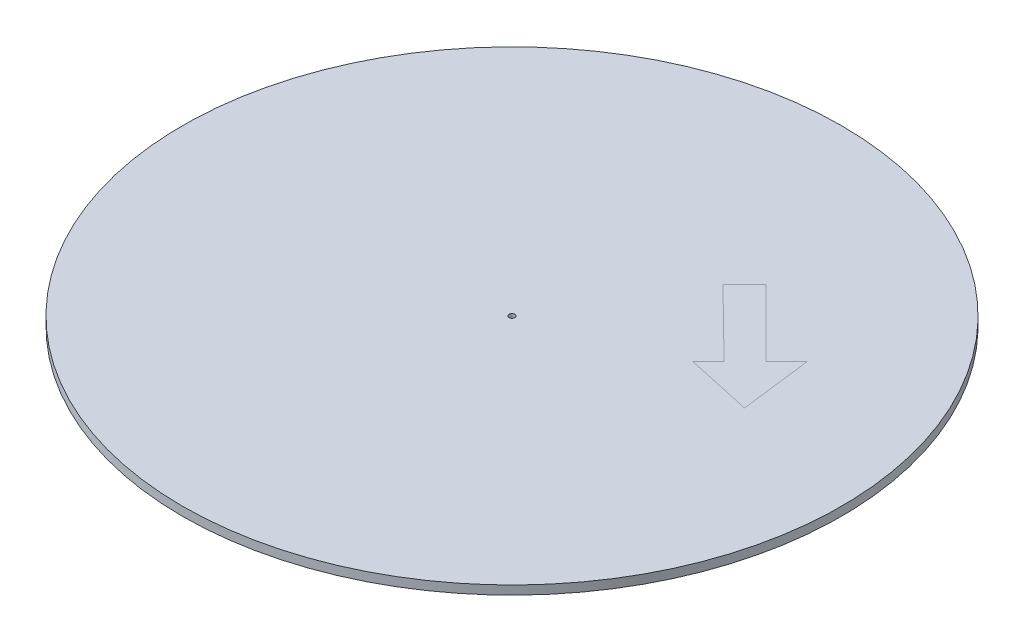
from build123d import *

# Parameters (mm, degrees)
CROQUIS2_R              = 112.5
SALIENTE_EXTRUIR1_DEPTH = 3
CORTAR_EXTRUIR1_REACH   = 161.127
CROQUIS3_R              = 1
CORTAR_EXTRUIR2_DEPTH   = 0.1


with BuildPart() as part:
    # Croquis2 → Saliente-Extruir1 (new body)
    with BuildSketch(Plane(origin=(0, 0, 0), x_dir=(1, 0, 0), z_dir=(0, 1, 0))):
        with Locations(Location((0, 0, 0), (0, 0, 270))):
            Circle(CROQUIS2_R)
    extrude(amount=SALIENTE_EXTRUIR1_DEPTH)

    # Croquis3 → Cortar-Extruir1 (cut, up to next)
    with BuildSketch(Plane(origin=(0, 3, 0), x_dir=(1, 0, 0), z_dir=(0, 1, 0)), mode=Mode.PRIVATE) as cortar_extruir1_sk1:
        with Locations(Location((0, 0, 0), (0, 0, 270))):
            Circle(CROQUIS3_R)
    cortar_extruir1_tool1 = extrude(cortar_extruir1_sk1.sketch, amount=-CORTAR_EXTRUIR1_REACH, mode=Mode.PRIVATE) & part.part
    add(cortar_extruir1_tool1.solids().sort_by_distance((0, 3, 0))[0], mode=Mode.SUBTRACT)

    # Croquis4 → Cortar-Extruir2 (cut)
    with BuildSketch(Plane(origin=(0, 3, 0), x_dir=(1, 0, 0), z_dir=(0, 1, 0))):
        Polygon((26.671111852, 45.340890148), (34.044889835, 52.714668131), (56.793779355, 29.96577861), (63.853779551, 37.025778806), (66.91311297, 12.472667013), (44.242667896, 17.41466715), (49.612104379, 22.784103634), align=None)
    extrude(amount=-CORTAR_EXTRUIR2_DEPTH, mode=Mode.SUBTRACT)


solid = part.part
